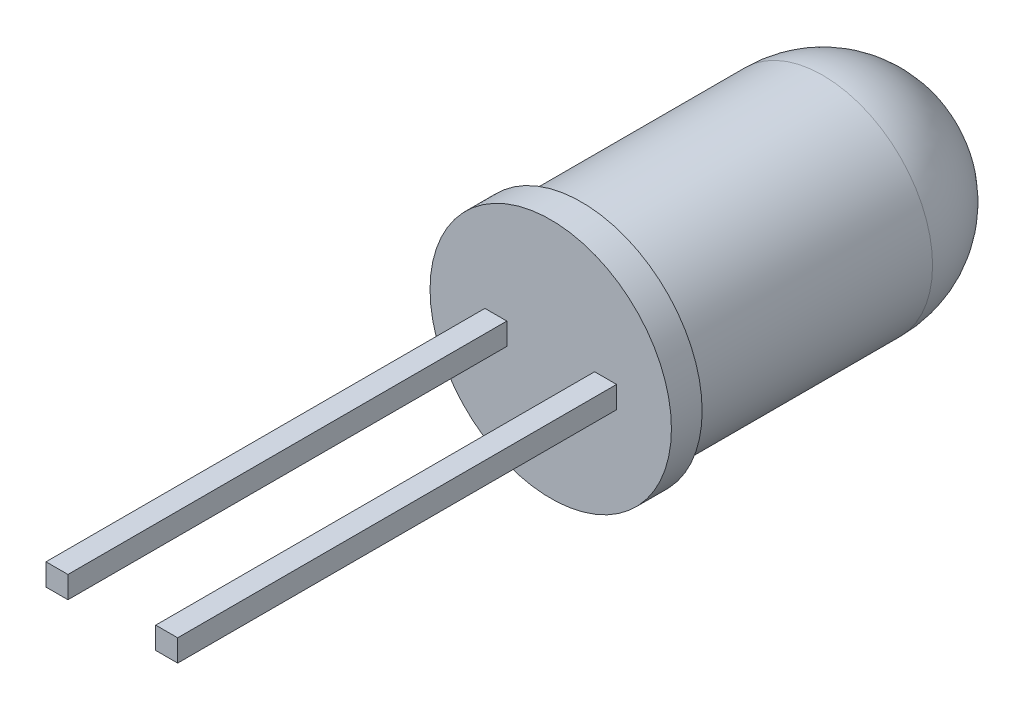
from build123d import *

# Parameters (mm, degrees)
ESQUISSE1_R        = 2.5
BOSS_EXTRU_1_DEPTH = 8
ESQUISSE2_R        = 2.75
BOSS_EXTRU_2_DEPTH = 0.7
ESQUISSE3_W        = 0.5
ESQUISSE3_H        = 0.5
BOSS_EXTRU_3_DEPTH = 10
CONG_1_R           = 2.5


with BuildPart() as part:
    # Esquisse1 → Boss.-Extru.1 (new body)
    with BuildSketch(Plane.XY):
        Circle(ESQUISSE1_R)
    extrude(amount=BOSS_EXTRU_1_DEPTH)

    # Esquisse2 → Boss.-Extru.2 (add)
    with BuildSketch(Plane.XY.offset(8)):
        Circle(ESQUISSE2_R)
    extrude(amount=BOSS_EXTRU_2_DEPTH)

    # Esquisse3 → Boss.-Extru.3 (add)
    with BuildSketch(Plane.XY.offset(8.7)):
        with Locations((-1.25, 0)):
            Rectangle(ESQUISSE3_W, ESQUISSE3_H)
        with Locations((1.25, 0)):
            Rectangle(ESQUISSE3_W, ESQUISSE3_H)
    extrude(amount=BOSS_EXTRU_3_DEPTH)

    # Congé1
    cong_1_edges = [part.edges().sort_by_distance(p)[0] for p in [
        (-2.5, 0, 0),
    ]]
    fillet(cong_1_edges, radius=CONG_1_R)


solid = part.part
